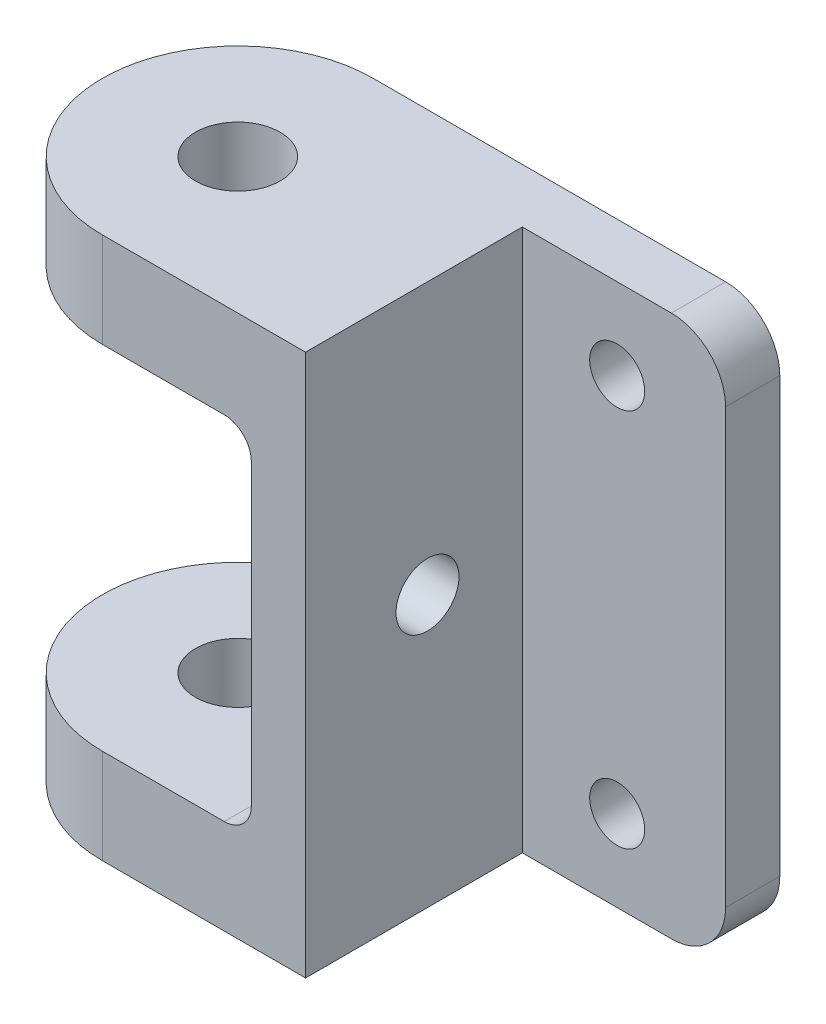
from build123d import *

# Parameters (mm, degrees)
SKETCH1_R           = 7.9375
BOSS_EXTRUDE1_DEPTH = 101.6
CUT_EXTRUDE1_DEPTH  = 153.4
SKETCH3_R           = 5.1562
CUT_EXTRUDE2_DEPTH  = 150.32089472
SKETCH4_R           = 5.903408011
CUT_EXTRUDE3_DEPTH  = 131.136274728
FILLET1_R           = 10.16


with BuildPart() as part:
    # Sketch1 → Boss-Extrude1 (new body)
    with BuildSketch(Plane(origin=(0, 0, 0), x_dir=(1, 0, 0), z_dir=(0, 1, 0))):
        with BuildLine():
            Line((0, 0), (-76.2, 0))
            ThreePointArc((-76.2, 0), (-101.6, -25.4), (-76.2, -50.8))
            Line((-76.2, -50.8), (-38.1, -50.8))
            Line((-38.1, -50.8), (-38.1, -10.16))
            Line((-38.1, -10.16), (0, -10.16))
            Line((0, -10.16), (0, 0))
        make_face()
        with Locations(Location((-76.2, -25.4, 0), (0, 0, 270))):
            Circle(SKETCH1_R, mode=Mode.SUBTRACT)
    extrude(amount=-BOSS_EXTRUDE1_DEPTH)

    # Sketch2 → Cut-Extrude1 (cut, through all)
    with BuildSketch(Plane.XY.offset(50.8)):
        with BuildLine():
            Line((-53.34, -17.78), (-111.029892198, -17.78))
            Line((-111.029892198, -17.78), (-111.029892198, -83.82))
            Line((-111.029892198, -83.82), (-53.34, -83.82))
            ThreePointArc((-53.34, -83.82), (-49.747897552, -82.332102448), (-48.26, -78.74))
            Line((-48.26, -78.74), (-48.26, -22.86))
            ThreePointArc((-48.26, -22.86), (-49.747897552, -19.267897552), (-53.34, -17.78))
        make_face()
    extrude(amount=-CUT_EXTRUDE1_DEPTH, mode=Mode.SUBTRACT)

    # Sketch3 → Cut-Extrude2 (cut, through all)
    with BuildSketch(Plane.XY.offset(10.16)):
        with Locations((-20.32, -15.24)):
            Circle(SKETCH3_R)
        with Locations((-20.32, -86.36)):
            Circle(SKETCH3_R)
    extrude(amount=-CUT_EXTRUDE2_DEPTH, mode=Mode.SUBTRACT)

    # Sketch4 → Cut-Extrude3 (cut, through all)
    with BuildSketch(Plane(origin=(-38.1, 0, 0), x_dir=(0, 0, -1), z_dir=(1, 0, 0))):
        with Locations((-27.94, -50.8)):
            Circle(SKETCH4_R)
    extrude(amount=-CUT_EXTRUDE3_DEPTH, mode=Mode.SUBTRACT)

    # Fillet1
    fillet1_edges = [part.edges().sort_by_distance(p)[0] for p in [
        (0, -101.6, 5.08),
        (0, 0, 5.08),
    ]]
    fillet(fillet1_edges, radius=FILLET1_R)


solid = part.part
